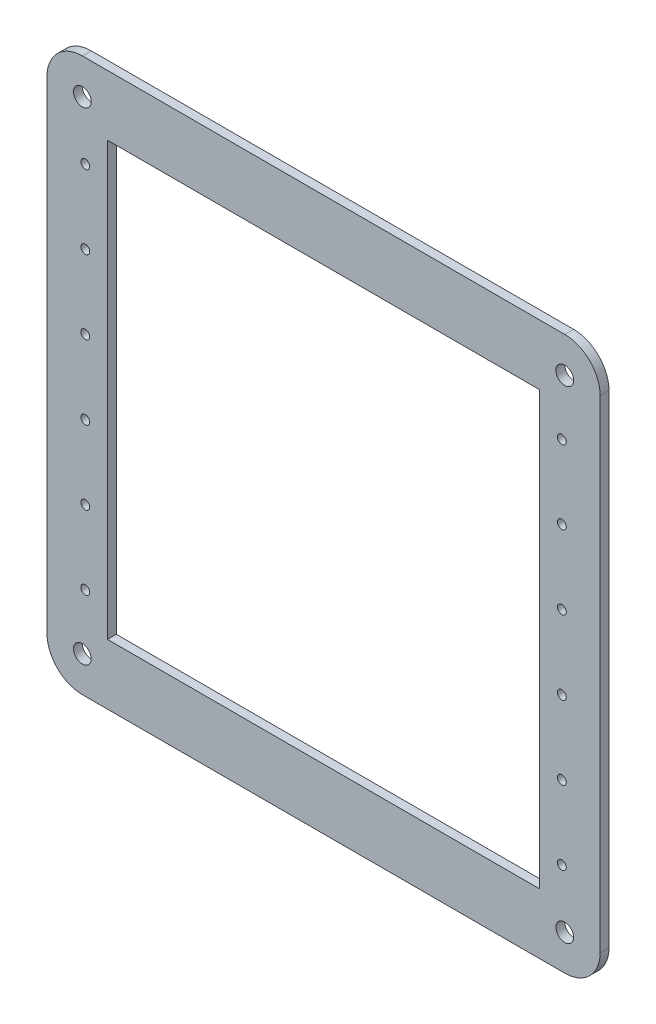
from build123d import *

# Parameters (mm, degrees)
SKETCH1_R           = 4
SKETCH1_W           = 195.372583002
SKETCH1_H           = 195.372583002
BOSS_EXTRUDE1_DEPTH = 4
SKETCH2_R           = 2
CUT_EXTRUDE1_DEPTH  = 10


with BuildPart() as part:
    # Sketch1 → Boss-Extrude1 (new body)
    with BuildSketch(Plane.XY):
        with BuildLine():
            Line((-109, 125), (109, 125))
            ThreePointArc((109, 125), (120.313708499, 120.313708499), (125, 109))
            Line((125, 109), (125, -109))
            ThreePointArc((125, -109), (120.313708499, -120.313708499), (109, -125))
            Line((109, -125), (-109, -125))
            ThreePointArc((-109, -125), (-120.313708499, -120.313708499), (-125, -109))
            Line((-125, -109), (-125, 109))
            ThreePointArc((-125, 109), (-120.313708499, 120.313708499), (-109, 125))
        make_face()
        with Locations((-109, 109)):
            Circle(SKETCH1_R, mode=Mode.SUBTRACT)
        with Locations((109, 109)):
            Circle(SKETCH1_R, mode=Mode.SUBTRACT)
        with Locations((109, -109)):
            Circle(SKETCH1_R, mode=Mode.SUBTRACT)
        with Locations((-109, -109)):
            Circle(SKETCH1_R, mode=Mode.SUBTRACT)
        Rectangle(SKETCH1_W, SKETCH1_H, mode=Mode.SUBTRACT)
    extrude(amount=BOSS_EXTRUDE1_DEPTH)

    # Sketch2 → Cut-Extrude1 (cut)
    with BuildSketch(Plane.XY.offset(4)):
        with Locations((-107.686291501, 83.3)):
            Circle(SKETCH2_R)
        with Locations((-107.686291501, 50)):
            Circle(SKETCH2_R)
        with Locations((-107.686291501, 16.7)):
            Circle(SKETCH2_R)
        with Locations((-107.686291501, -16.7)):
            Circle(SKETCH2_R)
        with Locations((-107.686291501, -50)):
            Circle(SKETCH2_R)
        with Locations((-107.686291501, -83.3)):
            Circle(SKETCH2_R)
        with Locations((107.686291501, -83.3)):
            Circle(SKETCH2_R)
        with Locations((107.686291501, -50)):
            Circle(SKETCH2_R)
        with Locations((107.686291501, -16.7)):
            Circle(SKETCH2_R)
        with Locations((107.686291501, 16.7)):
            Circle(SKETCH2_R)
        with Locations((107.686291501, 50)):
            Circle(SKETCH2_R)
        with Locations((107.686291501, 83.3)):
            Circle(SKETCH2_R)
    extrude(amount=-CUT_EXTRUDE1_DEPTH, mode=Mode.SUBTRACT)


solid = part.part
